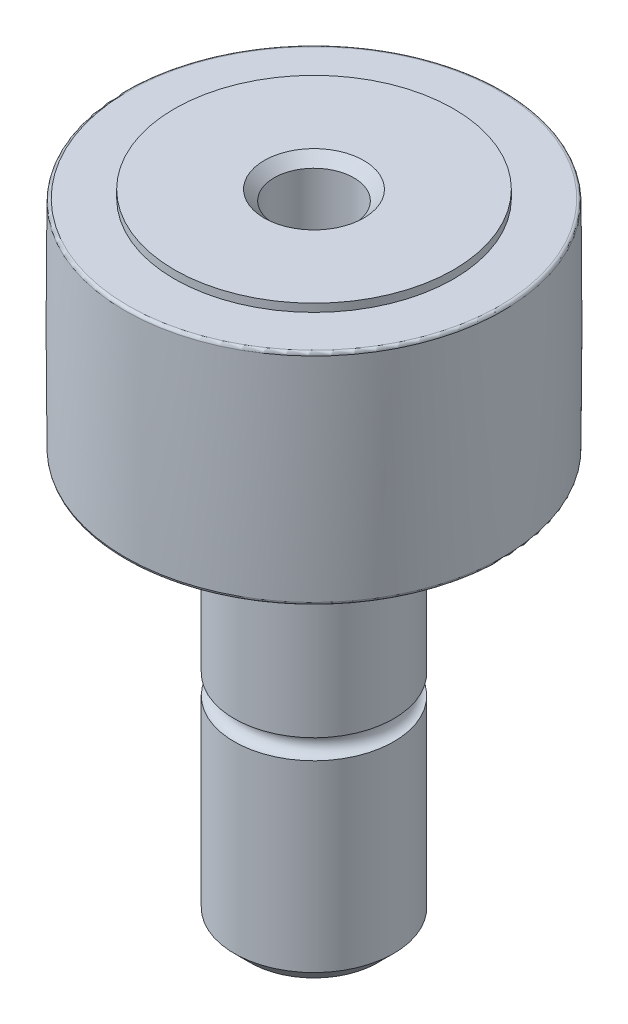
from build123d import *

# Parameters (mm, degrees)
CHANFREIN1_SIZE = 0.8
PER_AGE1_D      = 3
PER_AGE1_DEPTH  = 10
PER_AGE1_TIP    = 0.866025404
PER_AGE2_D      = 4
PER_AGE2_DEPTH  = 6
PER_AGE2_TIP    = 1.154700538
CONG_1_R        = 0.15
CHANFREIN2_SIZE = 0.5


with BuildPart() as part:
    # Esquisse1 → Base-Révolution (revolve)
    with BuildSketch(Plane.XY, mode=Mode.PRIVATE) as base_r_volution_sk:
        with BuildLine():
            Line((0, 0), (4, 0))
            Line((4, 0), (4, 10))
            ThreePointArc((4, 10), (3.5, 10.5), (4, 11))
            Line((4, 11), (4, 20))
            Line((4, 20), (7, 20))
            Line((7, 20), (7, 20.6))
            Line((7, 20.6), (9.469749085, 20.6))
            ThreePointArc((9.469749085, 20.6), (9.5, 26.1), (9.469749085, 31.6))
            Line((9.469749085, 31.6), (7, 31.6))
            Line((7, 31.6), (7, 32))
            Line((7, 32), (0, 32))
            Line((0, 32), (0, 0))
        make_face()
    revolve(base_r_volution_sk.sketch.rotate(Axis((0, -6.89025894, 0), (0, 1, 0)), 90), axis=Axis((0, -6.89025894, 0), (0, 1, 0)))

    # Chanfrein1
    chanfrein1_edges = [part.edges().sort_by_distance(p)[0] for p in [
        (0, 0, 4),
    ]]
    chamfer(chanfrein1_edges, length=CHANFREIN1_SIZE)

    # Perçage1
    with Locations(Plane(origin=(0, 32, 0), x_dir=(-1, 0, 0), z_dir=(0, 1, 0))):
        with Locations((0, 0)):
            Hole(PER_AGE1_D / 2, depth=PER_AGE1_DEPTH)
            with Locations((0, 0, -(PER_AGE1_DEPTH + PER_AGE1_TIP / 2))):  # 120° drill point
                Cone(0, PER_AGE1_D / 2, PER_AGE1_TIP, mode=Mode.SUBTRACT)

    # Perçage2
    with Locations(Plane(origin=(0, 32, 0), x_dir=(-1, 0, 0), z_dir=(0, 1, 0))):
        with Locations((0, 0)):
            Hole(PER_AGE2_D / 2, depth=PER_AGE2_DEPTH)
            with Locations((0, 0, -(PER_AGE2_DEPTH + PER_AGE2_TIP / 2))):  # 120° drill point
                Cone(0, PER_AGE2_D / 2, PER_AGE2_TIP, mode=Mode.SUBTRACT)

    # Congé1
    cong_1_edges = [part.edges().sort_by_distance(p)[0] for p in [
        (0, 20.6, 9.469749085),
        (0, 31.6, 9.469749085),
    ]]
    fillet(cong_1_edges, radius=CONG_1_R)

    # Chanfrein2
    chanfrein2_edges = [part.edges().sort_by_distance(p)[0] for p in [
        (-2, 32, 0),
    ]]
    chamfer(chanfrein2_edges, length=CHANFREIN2_SIZE)


solid = part.part
